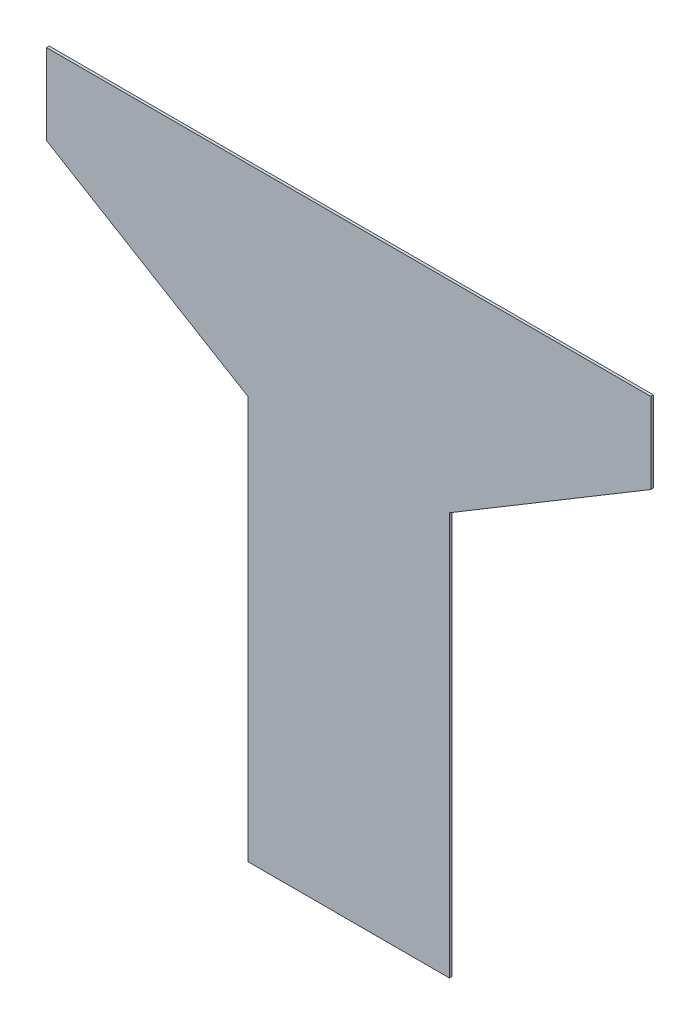
from build123d import *

# Parameters (mm, degrees)
BOSS_EXTRUDE1_DEPTH = 0.666666667
SCALE1_SCALE        = 3


with BuildPart() as part:
    # Sketch1 → Boss-Extrude1 (new body)
    with BuildSketch(Plane.XY):
        Polygon((75, 0), (-75, 0), (-75, -20), (-25, -50), (-25, -149.999999898), (25, -149.999999898), (25, -50), (75, -20), align=None)
    extrude(amount=BOSS_EXTRUDE1_DEPTH)


with BuildPart() as part_1:
    # Scale1: scaled about (0, -57.045454502, 0.333333333)
    add(part.part.scale(SCALE1_SCALE).moved(Location((0, 114.090909004, -0.666666666))))


solid = part_1.part
